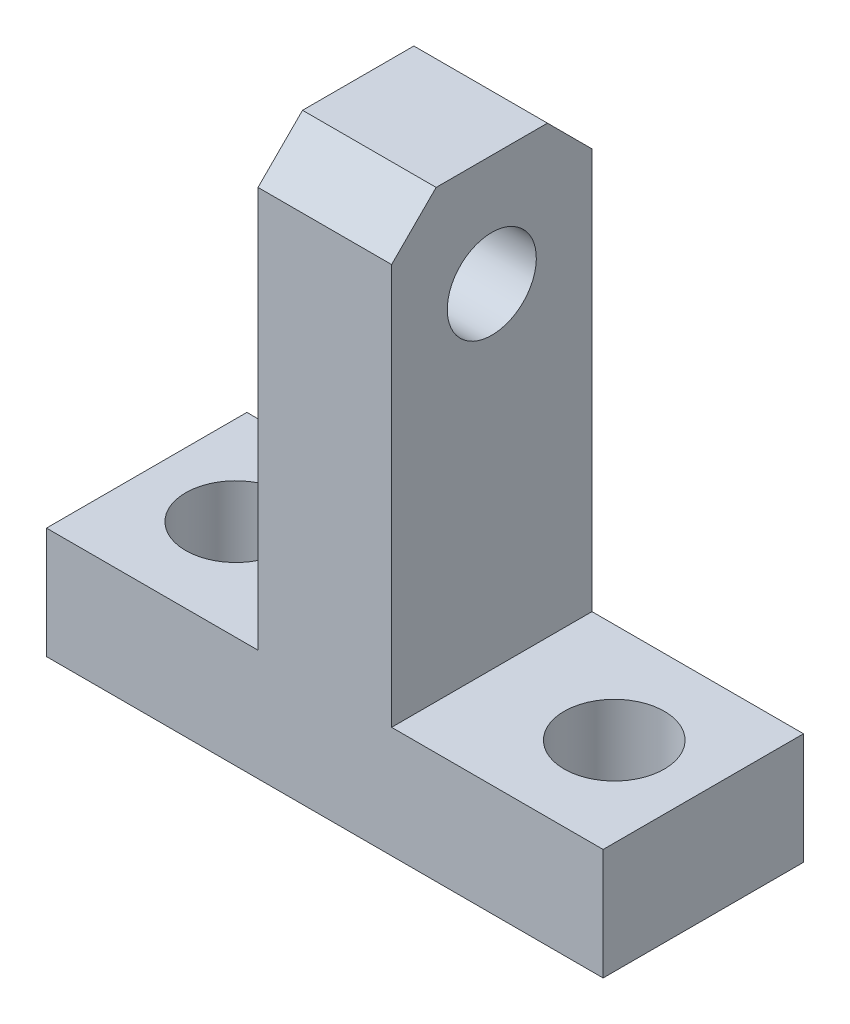
from build123d import *

# Parameters (mm, degrees)
BOSS_EXTRUDE1_DEPTH = 4.5
DIAMETER_HOLE1_D    = 4.5
CHAMFER1_SIZE       = 2
SKETCH4_R           = 2
CUT_EXTRUDE1_DEPTH  = 30.757352033


with BuildPart() as part:
    # Sketch1 → Boss-Extrude1 (new, symmetric)
    with BuildSketch(Plane.XY):
        Polygon((12.5, 0), (-12.5, 0), (-12.5, 5), (-3, 5), (-3, 25), (3, 25), (3, 5), (12.5, 5), align=None)
    extrude(amount=BOSS_EXTRUDE1_DEPTH, both=True)

    # Diameter Hole1 (through all)
    with Locations(Plane(origin=(0, 5, 0), x_dir=(1, 0, 0), z_dir=(0, 1, 0))):
        with Locations((-8.5, 0), (8.5, 0)):
            Hole(DIAMETER_HOLE1_D / 2)

    # Chamfer1
    chamfer1_edges = [part.edges().sort_by_distance(p)[0] for p in [
        (0, 25, 4.5),
        (0, 25, -4.5),
    ]]
    chamfer(chamfer1_edges, length=CHAMFER1_SIZE)

    # Sketch4 → Cut-Extrude1 (cut, through all)
    with BuildSketch(Plane(origin=(3, 0, 0), x_dir=(0, 0, -1), z_dir=(1, 0, 0))):
        with Locations(Location((0, 20, 0), (0, 0, 90))):
            Circle(SKETCH4_R)
    extrude(amount=-CUT_EXTRUDE1_DEPTH, mode=Mode.SUBTRACT)


solid = part.part
